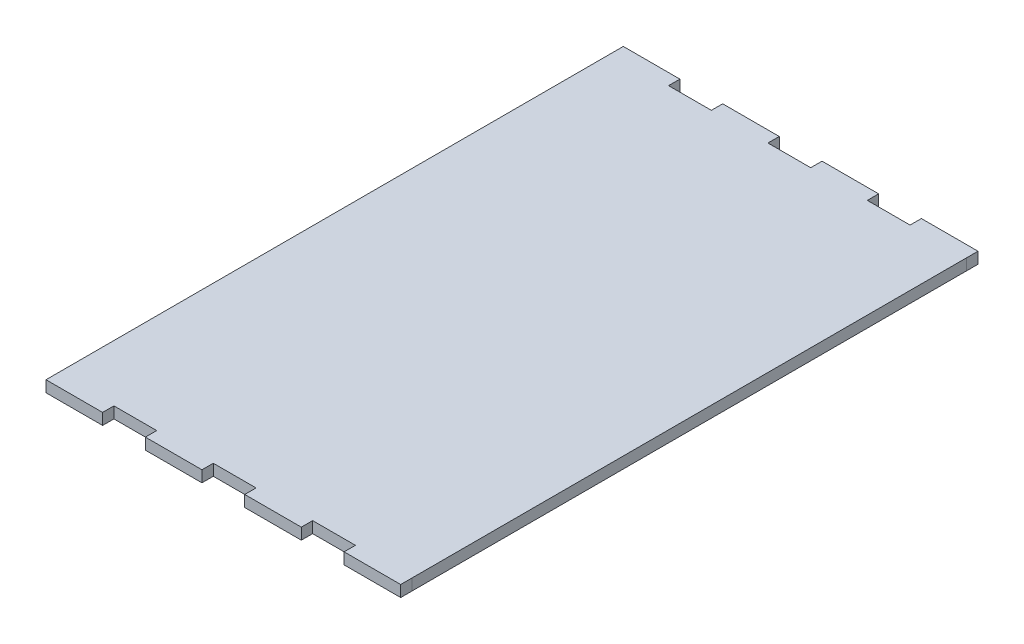
from build123d import *

# Parameters (mm, degrees)
BOSS_EXTRU_2_DEPTH = 6


with BuildPart() as part:
    # Esquisse1 → Boss.-Extru.2 (new body)
    with BuildSketch(Plane(origin=(0, 0, 0), x_dir=(1, 0, 0), z_dir=(0, 1, 0))):
        Polygon((30, 0), (52.67, 0), (52.67, -6), (82.67, -6), (82.67, 0), (105.34, 0), (105.34, -6), (135.34, -6), (135.34, 0), (158.01, 0), (158.01, -6), (188.01, -6), (188.01, 0), (188, 0), (188, 294), (188.01, 294), (188.01, 300), (158.01, 300), (158.01, 294), (135.34, 294), (135.34, 300), (105.34, 300), (105.34, 294), (82.67, 294), (82.67, 300), (52.67, 300), (52.67, 294), (30, 294), (30, 300), (0, 300), (0, 294), (0, 0), (0, -6), (30, -6), align=None)
    extrude(amount=BOSS_EXTRU_2_DEPTH)


solid = part.part
